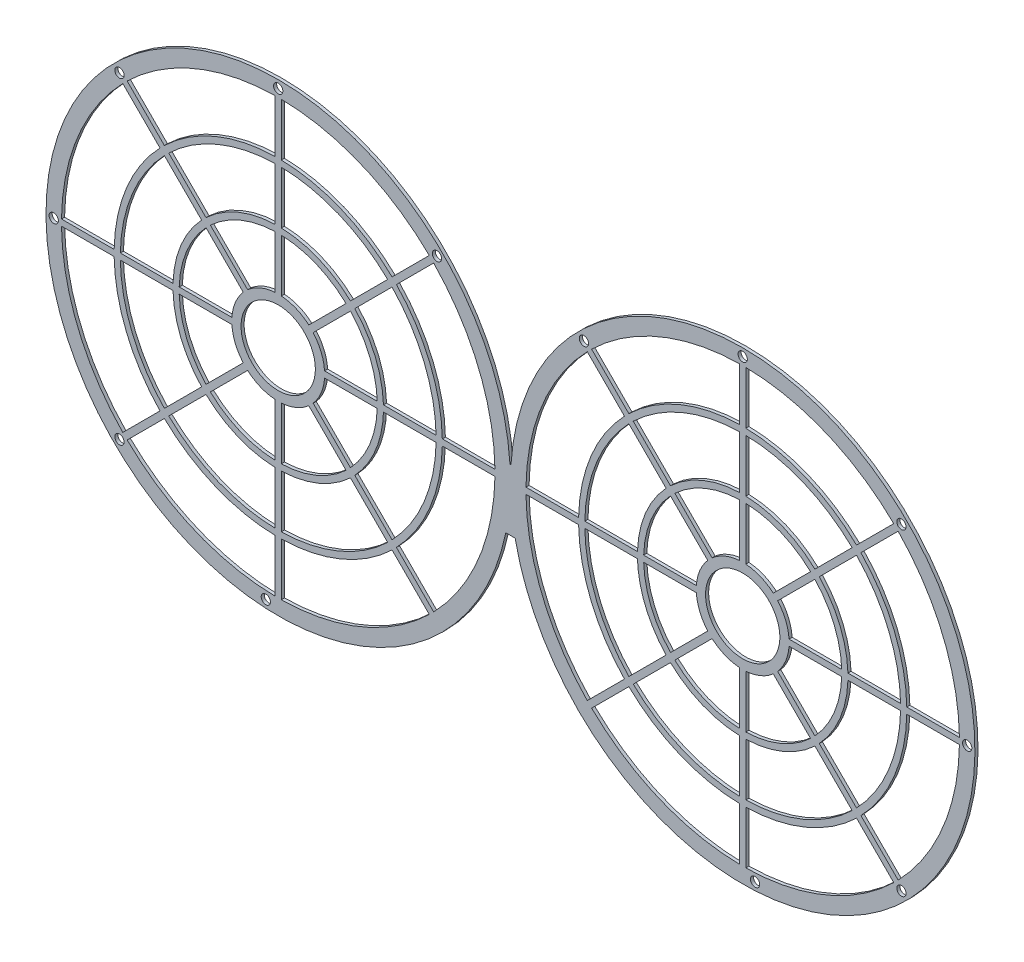
from build123d import *

# Parameters (mm, degrees)
SKETCH_2_R      = 12
SKETCH_2_R_2    = 1.5
EXTRUDE_1_DEPTH = 1


with BuildPart() as part:
    # 草图2 → 凸台-拉伸1 (new body)
    with BuildSketch(Plane.XY):
        with BuildLine():
            Line((-53.265307717, 10.171351817), (-51.75, 10.171351817))
            Line((-51.75, 10.171351817), (-51.75, 30))
            Line((-51.75, 30), (-51.905600365, 30))
            ThreePointArc((-51.905600365, 30), (-201.574285493, 30.30226796), (-53.265307717, 10.171351817))
        make_face()
        with BuildLine():
            Line((-125.75, -6.813019367), (-125.75, 10.20472227))
            ThreePointArc((-125.75, 10.20472227), (-121.009748515, 11.313158829), (-116.874101537, 13.881239791))
            Line((-116.874101537, 13.881239791), (-104.840741025, 1.84787928))
            ThreePointArc((-104.840741025, 1.84787928), (-114.504130164, -4.392793224), (-125.75, -6.813019367))
        make_face(mode=Mode.SUBTRACT)
        with BuildLine():
            Line((-103.426527463, 3.262092842), (-115.459887975, 15.295453354))
            ThreePointArc((-115.459887975, 15.295453354), (-112.891807012, 19.431100331), (-111.783370453, 24.171351817))
            Line((-111.783370453, 24.171351817), (-94.765628817, 24.171351817))
            ThreePointArc((-94.765628817, 24.171351817), (-97.18585496, 12.925481981), (-103.426527463, 3.262092842))
        make_face(mode=Mode.SUBTRACT)
        with BuildLine():
            Line((-94.765628817, 26.171351817), (-111.783370453, 26.171351817))
            ThreePointArc((-111.783370453, 26.171351817), (-112.891807012, 30.911603302), (-115.459887975, 35.04725028))
            Line((-115.459887975, 35.04725028), (-103.426527463, 47.080610791))
            ThreePointArc((-103.426527463, 47.080610791), (-97.18585496, 37.417221652), (-94.765628817, 26.171351817))
        make_face(mode=Mode.SUBTRACT)
        with BuildLine():
            Line((-104.840741025, 48.494824354), (-116.874101537, 36.461463842))
            ThreePointArc((-116.874101537, 36.461463842), (-121.009748515, 39.029544804), (-125.75, 40.137981364))
            Line((-125.75, 40.137981364), (-125.75, 57.155723))
            ThreePointArc((-125.75, 57.155723), (-114.504130164, 54.735496857), (-104.840741025, 48.494824354))
        make_face(mode=Mode.SUBTRACT)
        with BuildLine():
            Line((-127.75, 57.155723), (-127.75, 40.137981364))
            ThreePointArc((-127.75, 40.137981364), (-132.490251485, 39.029544804), (-136.625898463, 36.461463842))
            Line((-136.625898463, 36.461463842), (-148.659258975, 48.494824354))
            ThreePointArc((-148.659258975, 48.494824354), (-138.995869836, 54.735496857), (-127.75, 57.155723))
        make_face(mode=Mode.SUBTRACT)
        with BuildLine():
            Line((-150.073472537, 47.080610791), (-138.040112025, 35.04725028))
            ThreePointArc((-138.040112025, 35.04725028), (-140.608192988, 30.911603302), (-141.716629547, 26.171351817))
            Line((-141.716629547, 26.171351817), (-158.734371183, 26.171351817))
            ThreePointArc((-158.734371183, 26.171351817), (-156.31414504, 37.417221652), (-150.073472537, 47.080610791))
        make_face(mode=Mode.SUBTRACT)
        with BuildLine():
            Line((-158.734371183, 24.171351817), (-141.716629547, 24.171351817))
            ThreePointArc((-141.716629547, 24.171351817), (-140.608192988, 19.431100331), (-138.040112025, 15.295453354))
            Line((-138.040112025, 15.295453354), (-150.073472537, 3.262092842))
            ThreePointArc((-150.073472537, 3.262092842), (-156.31414504, 12.925481981), (-158.734371183, 24.171351817))
        make_face(mode=Mode.SUBTRACT)
        with BuildLine():
            Line((-148.659258975, 1.84787928), (-136.625898463, 13.881239791))
            ThreePointArc((-136.625898463, 13.881239791), (-132.490251485, 11.313158829), (-127.75, 10.20472227))
            Line((-127.75, 10.20472227), (-127.75, -6.813019367))
            ThreePointArc((-127.75, -6.813019367), (-138.995869836, -4.392793224), (-148.659258975, 1.84787928))
        make_face(mode=Mode.SUBTRACT)
        with Locations((-126.75, 25.171351817)):
            Circle(SKETCH_2_R, mode=Mode.SUBTRACT)
        with BuildLine():
            Line((-103.4258771, 0.433015354), (-91.401594027, -11.591267719))
            ThreePointArc((-91.401594027, -11.591267719), (-107.233144949, -21.946504341), (-125.75, -25.818843319))
            Line((-125.75, -25.818843319), (-125.75, -8.813939119))
            ThreePointArc((-125.75, -8.813939119), (-113.7387633, -6.240552289), (-103.4258771, 0.433015354))
        make_face(mode=Mode.SUBTRACT)
        with BuildLine():
            Line((-89.987380464, -10.177054157), (-102.011663537, 1.847228917))
            ThreePointArc((-102.011663537, 1.847228917), (-95.942347361, 10.787731311), (-92.984955401, 21.181143394))
            Line((-92.984955401, 21.181143394), (-92.764709064, 24.171351817))
            Line((-92.764709064, 24.171351817), (-75.759804864, 24.171351817))
            ThreePointArc((-75.759804864, 24.171351817), (-79.632143842, 5.654496766), (-89.987380464, -10.177054157))
        make_face(mode=Mode.SUBTRACT)
        with BuildLine():
            Line((-75.759804864, 26.171351817), (-92.764709064, 26.171351817))
            ThreePointArc((-92.764709064, 26.171351817), (-95.338095895, 38.182588517), (-102.011663537, 48.495474717))
            Line((-102.011663537, 48.495474717), (-89.987380464, 60.51975779))
            ThreePointArc((-89.987380464, 60.51975779), (-79.632143842, 44.688206867), (-75.759804864, 26.171351817))
        make_face(mode=Mode.SUBTRACT)
        with BuildLine():
            Line((-91.401594027, 61.933971353), (-103.4258771, 49.909688279))
            ThreePointArc((-103.4258771, 49.909688279), (-113.7387633, 56.583255922), (-125.75, 59.156642753))
            Line((-125.75, 59.156642753), (-125.75, 76.161546953))
            ThreePointArc((-125.75, 76.161546953), (-107.233144949, 72.289207975), (-91.401594027, 61.933971353))
        make_face(mode=Mode.SUBTRACT)
        with BuildLine():
            Line((-127.75, 76.161546953), (-127.75, 59.156642753))
            ThreePointArc((-127.75, 59.156642753), (-139.7612367, 56.583255922), (-150.0741229, 49.909688279))
            Line((-150.0741229, 49.909688279), (-162.098405973, 61.933971353))
            ThreePointArc((-162.098405973, 61.933971353), (-146.266855051, 72.289207975), (-127.75, 76.161546953))
        make_face(mode=Mode.SUBTRACT)
        with BuildLine():
            Line((-163.512619536, 60.51975779), (-151.488336463, 48.495474717))
            ThreePointArc((-151.488336463, 48.495474717), (-158.161904105, 38.182588517), (-160.735290936, 26.171351817))
            Line((-160.735290936, 26.171351817), (-177.740195136, 26.171351817))
            ThreePointArc((-177.740195136, 26.171351817), (-173.867856158, 44.688206867), (-163.512619536, 60.51975779))
        make_face(mode=Mode.SUBTRACT)
        with BuildLine():
            Line((-177.740195136, 24.171351817), (-160.735290936, 24.171351817))
            ThreePointArc((-160.735290936, 24.171351817), (-158.161904105, 12.160115116), (-151.488336463, 1.847228917))
            Line((-151.488336463, 1.847228917), (-163.512619536, -10.177054157))
            ThreePointArc((-163.512619536, -10.177054157), (-173.867856158, 5.654496766), (-177.740195136, 24.171351817))
        make_face(mode=Mode.SUBTRACT)
        with BuildLine():
            Line((-162.098405973, -11.591267719), (-150.0741229, 0.433015354))
            ThreePointArc((-150.0741229, 0.433015354), (-139.7612367, -6.240552289), (-127.75, -8.813939119))
            Line((-127.75, -8.813939119), (-127.75, -25.818843319))
            ThreePointArc((-127.75, -25.818843319), (-146.266855051, -21.946504341), (-162.098405973, -11.591267719))
        make_face(mode=Mode.SUBTRACT)
        with BuildLine():
            Line((-73.759434802, 24.171351817), (-56.757143222, 24.171351817))
            ThreePointArc((-56.757143222, 24.171351817), (-62.078432724, -1.616488449), (-76.550469556, -23.613965065))
            Line((-76.550469556, -23.613965065), (-88.572905228, -11.591529392))
            ThreePointArc((-88.572905228, -11.591529392), (-77.784384777, 4.889129901), (-73.759434802, 24.171351817))
        make_face(mode=Mode.SUBTRACT)
        with BuildLine():
            Line((-56.757143222, 26.171351817), (-73.759434802, 26.171351817))
            ThreePointArc((-73.759434802, 26.171351817), (-77.784384777, 45.453573732), (-88.572905228, 61.934233026))
            Line((-88.572905228, 61.934233026), (-76.550469556, 73.956668698))
            ThreePointArc((-76.550469556, 73.956668698), (-62.078432724, 51.959192082), (-56.757143222, 26.171351817))
        make_face(mode=Mode.SUBTRACT)
        with BuildLine():
            Line((-77.964683119, 75.370882261), (-89.987118791, 63.348446588))
            ThreePointArc((-89.987118791, 63.348446588), (-106.467778085, 74.13696704), (-125.75, 78.161917015))
            Line((-125.75, 78.161917015), (-125.75, 95.164208595))
            ThreePointArc((-125.75, 95.164208595), (-99.962159734, 89.842919093), (-77.964683119, 75.370882261))
        make_face(mode=Mode.SUBTRACT)
        with BuildLine():
            Line((-127.75, 95.164208595), (-127.75, 78.161917015))
            ThreePointArc((-127.75, 78.161917015), (-147.032221915, 74.13696704), (-163.512881209, 63.348446588))
            Line((-163.512881209, 63.348446588), (-175.535316881, 75.370882261))
            ThreePointArc((-175.535316881, 75.370882261), (-153.537840266, 89.842919093), (-127.75, 95.164208595))
        make_face(mode=Mode.SUBTRACT)
        with BuildLine():
            Line((-176.949530444, 73.956668698), (-164.927094772, 61.934233026))
            ThreePointArc((-164.927094772, 61.934233026), (-175.715615223, 45.453573732), (-179.740565198, 26.171351817))
            Line((-179.740565198, 26.171351817), (-196.742856778, 26.171351817))
            ThreePointArc((-196.742856778, 26.171351817), (-191.421567276, 51.959192082), (-176.949530444, 73.956668698))
        make_face(mode=Mode.SUBTRACT)
        with BuildLine():
            Line((-196.742856778, 24.171351817), (-179.740565198, 24.171351817))
            ThreePointArc((-179.740565198, 24.171351817), (-175.715615223, 4.889129901), (-164.927094772, -11.591529392))
            Line((-164.927094772, -11.591529392), (-176.949530444, -23.613965065))
            ThreePointArc((-176.949530444, -23.613965065), (-191.421567276, -1.616488449), (-196.742856778, 24.171351817))
        make_face(mode=Mode.SUBTRACT)
        with BuildLine():
            Line((-175.535316881, -25.028178627), (-163.512881209, -13.005742955))
            ThreePointArc((-163.512881209, -13.005742955), (-147.032221915, -23.794263406), (-127.75, -27.819213381))
            Line((-127.75, -27.819213381), (-127.75, -44.821504962))
            ThreePointArc((-127.75, -44.821504962), (-153.537840266, -39.500215459), (-175.535316881, -25.028178627))
        make_face(mode=Mode.SUBTRACT)
        with BuildLine():
            Line((-125.75, -44.821504962), (-125.75, -27.819213381))
            ThreePointArc((-125.75, -27.819213381), (-106.467778085, -23.794263406), (-89.987118791, -13.005742955))
            Line((-89.987118791, -13.005742955), (-77.964683119, -25.028178627))
            ThreePointArc((-77.964683119, -25.028178627), (-99.962159734, -39.500215459), (-125.75, -44.821504962))
        make_face(mode=Mode.SUBTRACT)
        with Locations((-178.015241636, -26.093889819)):
            Circle(SKETCH_2_R_2, mode=Mode.SUBTRACT)
        with Locations((-130.75, -47.218219255)):
            Circle(SKETCH_2_R_2, mode=Mode.SUBTRACT)
        with Locations((-199.25, 25.171351817)):
            Circle(SKETCH_2_R_2, mode=Mode.SUBTRACT)
        with Locations((-178.015241636, 76.436593453)):
            Circle(SKETCH_2_R_2, mode=Mode.SUBTRACT)
        with Locations((-126.75, 97.671351817)):
            Circle(SKETCH_2_R_2, mode=Mode.SUBTRACT)
        with Locations((-75.484758364, 76.436593453)):
            Circle(SKETCH_2_R_2, mode=Mode.SUBTRACT)
    extrude(amount=EXTRUDE_1_DEPTH)

    # 镜向1: part across face


with BuildPart() as part_1:
    add(part.part)
    add(part.part.mirror(Plane(origin=(-51.75, 20.085675908, 0.5), x_dir=(0, 0, 1), z_dir=(1, 0, 0))))


solid = part_1.part
